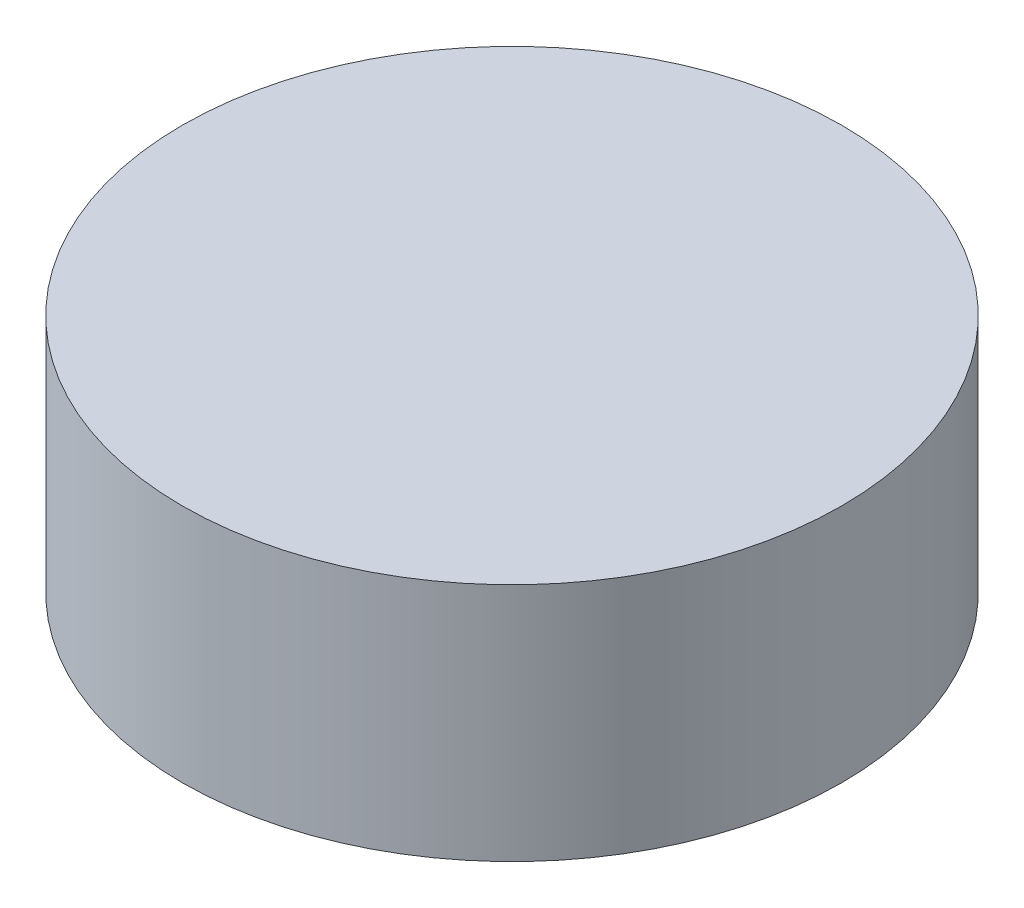
from build123d import *

# Parameters (mm, degrees)
SKETCH1_R           = 5.5
BOSS_EXTRUDE1_DEPTH = 4


with BuildPart() as part:
    # Sketch1 → Boss-Extrude1 (new body)
    with BuildSketch(Plane(origin=(0, 0, 0), x_dir=(1, 0, 0), z_dir=(0, 1, 0))):
        with Locations(Location((0, 0, 0), (0, 0, 270))):
            Circle(SKETCH1_R)
    extrude(amount=BOSS_EXTRUDE1_DEPTH)


solid = part.part
